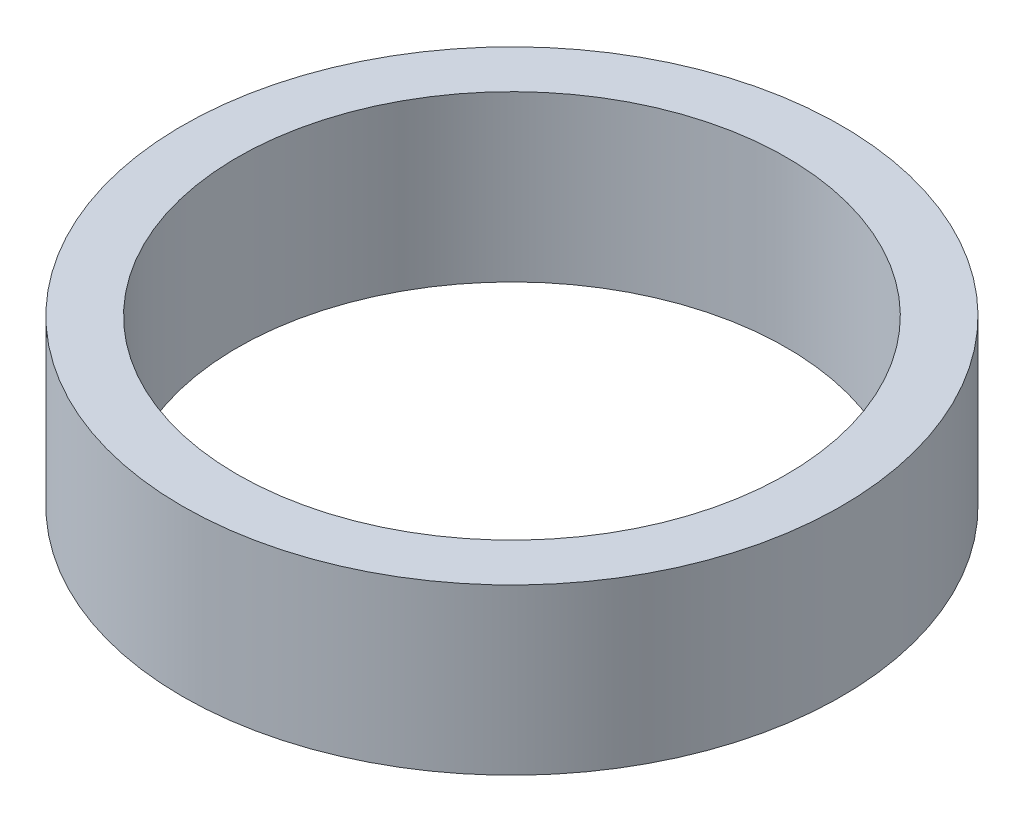
from build123d import *

# Parameters (mm, degrees)
SKETCH1_R           = 30
SKETCH1_R_2         = 25
BOSS_EXTRUDE1_DEPTH = 15


with BuildPart() as part:
    # Sketch1 → Boss-Extrude1 (new body)
    with BuildSketch(Plane(origin=(0, 0, 0), x_dir=(1, 0, 0), z_dir=(0, 1, 0))):
        with Locations(Location((0, 0, 0), (0, 0, 270))):
            Circle(SKETCH1_R)
        with Locations(Location((0, 0, 0), (0, 0, 270))):
            Circle(SKETCH1_R_2, mode=Mode.SUBTRACT)
    extrude(amount=BOSS_EXTRUDE1_DEPTH)


solid = part.part
